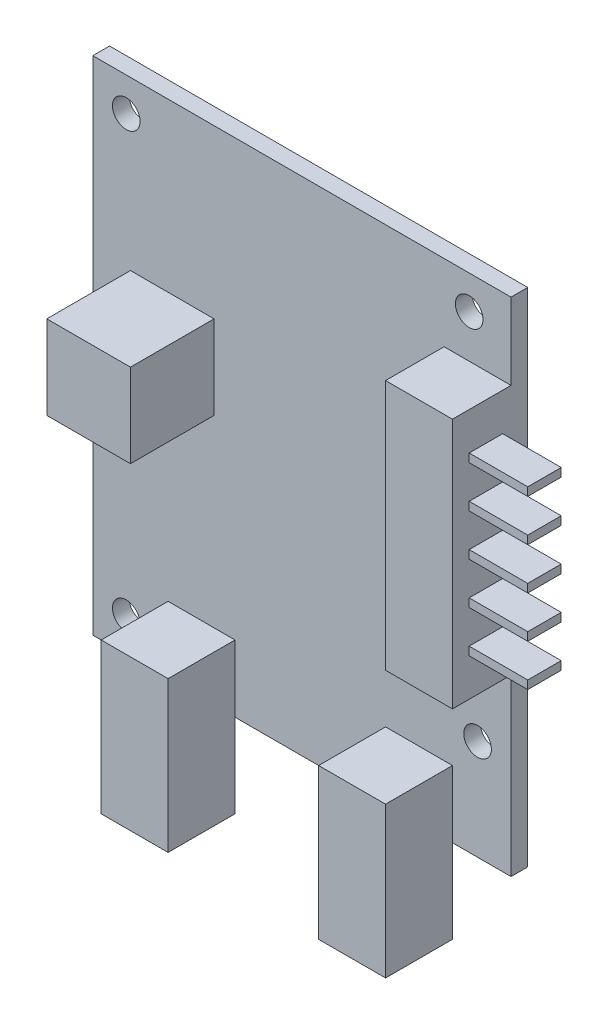
from build123d import *

# Parameters (mm, degrees)
ESQUISSE1_W        = 50
ESQUISSE1_H        = 60
ESQUISSE1_R        = 1.65
BOSS_EXTRU_1_DEPTH = 2
ESQUISSE2_W        = 8
ESQUISSE2_H        = 18
BOSS_EXTRU_2_DEPTH = 8
ESQUISSE3_W        = 10
ESQUISSE3_H        = 10
BOSS_EXTRU_3_DEPTH = 10
ESQUISSE4_W        = 8
ESQUISSE4_H        = 30
BOSS_EXTRU_4_DEPTH = 7
ESQUISSE5_W        = 4
ESQUISSE5_H        = 1
BOSS_EXTRU_5_DEPTH = 7


with BuildPart() as part:
    # Esquisse1 → Boss.-Extru.1 (new body)
    with BuildSketch(Plane.XY):
        with Locations((1.490133333, 29.802666667)):
            Rectangle(ESQUISSE1_W, ESQUISSE1_H)
        with Locations((-19.509866667, 55.802666667)):
            Circle(ESQUISSE1_R, mode=Mode.SUBTRACT)
        with Locations((21.490133333, 55.802666667)):
            Circle(ESQUISSE1_R, mode=Mode.SUBTRACT)
        with Locations((22.490133333, 11.802666667)):
            Circle(ESQUISSE1_R, mode=Mode.SUBTRACT)
        with Locations((-19.509866667, 3.802666667)):
            Circle(ESQUISSE1_R, mode=Mode.SUBTRACT)
    extrude(amount=BOSS_EXTRU_1_DEPTH)

    # Esquisse2 → Boss.-Extru.2 (add)
    with BuildSketch(Plane.XY.offset(2)):
        with Locations((-10.509866667, -1.197333333)):
            Rectangle(ESQUISSE2_W, ESQUISSE2_H)
        with Locations((15.490133333, -1.197333333)):
            Rectangle(ESQUISSE2_W, ESQUISSE2_H)
    extrude(amount=BOSS_EXTRU_2_DEPTH)

    # Esquisse3 → Boss.-Extru.3 (add)
    with BuildSketch(Plane.XY.offset(2)):
        with Locations((-14.009866667, 34.802666667)):
            Rectangle(ESQUISSE3_W, ESQUISSE3_H)
    extrude(amount=BOSS_EXTRU_3_DEPTH)

    # Esquisse4 → Boss.-Extru.4 (add)
    with BuildSketch(Plane.XY.offset(2)):
        with Locations((22.490133333, 35.662666667)):
            Rectangle(ESQUISSE4_W, ESQUISSE4_H)
    extrude(amount=BOSS_EXTRU_4_DEPTH)

    # Esquisse5 → Boss.-Extru.5 (add)
    with BuildSketch(Plane(origin=(26.490133333, 0, 0), x_dir=(0, 0, -1), z_dir=(1, 0, 0))):
        with Locations((-5, 35.662666667)):
            Rectangle(ESQUISSE5_W, ESQUISSE5_H)
        with Locations((-5, 40.662666667)):
            Rectangle(ESQUISSE5_W, ESQUISSE5_H)
        with Locations((-5, 45.662666667)):
            Rectangle(ESQUISSE5_W, ESQUISSE5_H)
        with Locations((-5, 30.662666667)):
            Rectangle(ESQUISSE5_W, ESQUISSE5_H)
        with Locations((-5, 25.662666667)):
            Rectangle(ESQUISSE5_W, ESQUISSE5_H)
    extrude(amount=BOSS_EXTRU_5_DEPTH)


solid = part.part
